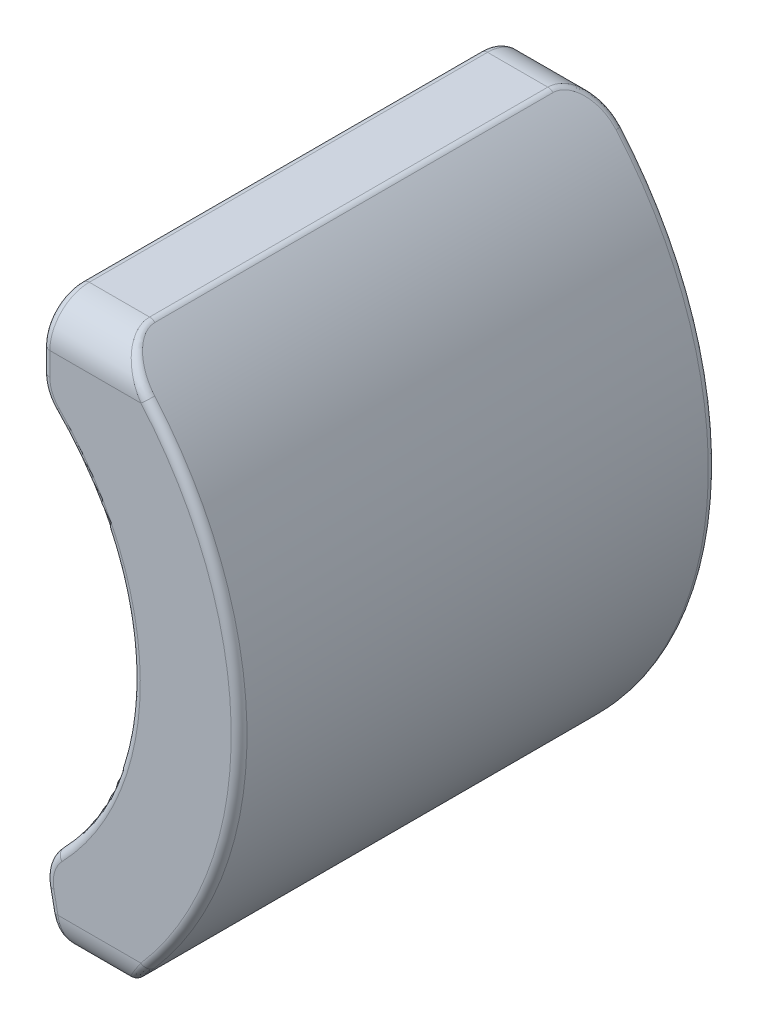
from build123d import *

# Parameters (mm, degrees)
BOSS_EXTRUDE1_DEPTH = 6.05
FILLET1_R           = 0.5
FILLET2_R           = 0.1


with BuildPart() as part:
    # Sketch1 → Boss-Extrude1 (new body)
    with BuildSketch(Plane.XY):
        with BuildLine():
            Line((2.5, -3.575), (3.203025913, -3.575))
            ThreePointArc((3.203025913, -3.575), (4.8, 0), (3.203025913, 3.575))
            Line((3.203025913, 3.575), (2.3, 3.575))
            Line((2.3, 3.575), (2.3, 2.567103802))
            ThreePointArc((2.3, 2.567103802), (3.446740769, 0), (2.3, -2.567103802))
            Line((2.3, -2.567103802), (2.5, -3.575))
        make_face()
    extrude(amount=BOSS_EXTRUDE1_DEPTH)

    # Fillet1
    fillet1_edges = [part.edges().sort_by_distance(p)[0] for p in [
        (2.751512957, 3.575, 0),
        (2.3, 2.567103802, 3.025),
        (2.3, -2.567103802, 3.025),
        (2.851512957, -3.575, 0),
        (2.851512957, -3.575, 6.05),
        (2.751512957, 3.575, 6.05),
    ]]
    fillet(fillet1_edges, radius=FILLET1_R)

    # Fillet2
    fillet2_edges = [part.edges().sort_by_distance(p)[0] for p in [
        (2.5, -3.575, 3.025),
        (3.203025913, -3.575, 3.025),
        (4.8, 0, 6.05),
        (4.8, 0, 0),
        (3.203025913, 3.575, 3.025),
        (3.383378785, 3.40481248, 5.925797449),
        (3.383378785, 3.40481248, 0.124202551),
        (3.383378797, -3.404812467, 5.92579746),
        (3.383378797, -3.404812467, 0.12420254),
        (2.376908676, -2.954683613, 0),
        (3.446633835, 0.027150287, 0),
        (2.3, 2.928251838, 0),
        (2.337743829, 2.590927621, 0),
        (2.363671694, -2.596363527, 0),
        (2.376908676, -2.954683613, 6.05),
        (2.470600688, -3.426842727, 5.905255817),
        (2.470600688, -3.426842727, 0.144744183),
        (2.3, 2.928251838, 6.05),
        (3.446633835, 0.027150287, 6.05),
        (2.337743829, 2.590927621, 6.05),
        (2.363671694, -2.596363527, 6.05),
        (2.3, 3.575, 3.025),
        (2.3, 3.428553391, 5.903553391),
        (2.3, 3.428553391, 0.146446609),
    ]]
    fillet(fillet2_edges, radius=FILLET2_R)


solid = part.part
